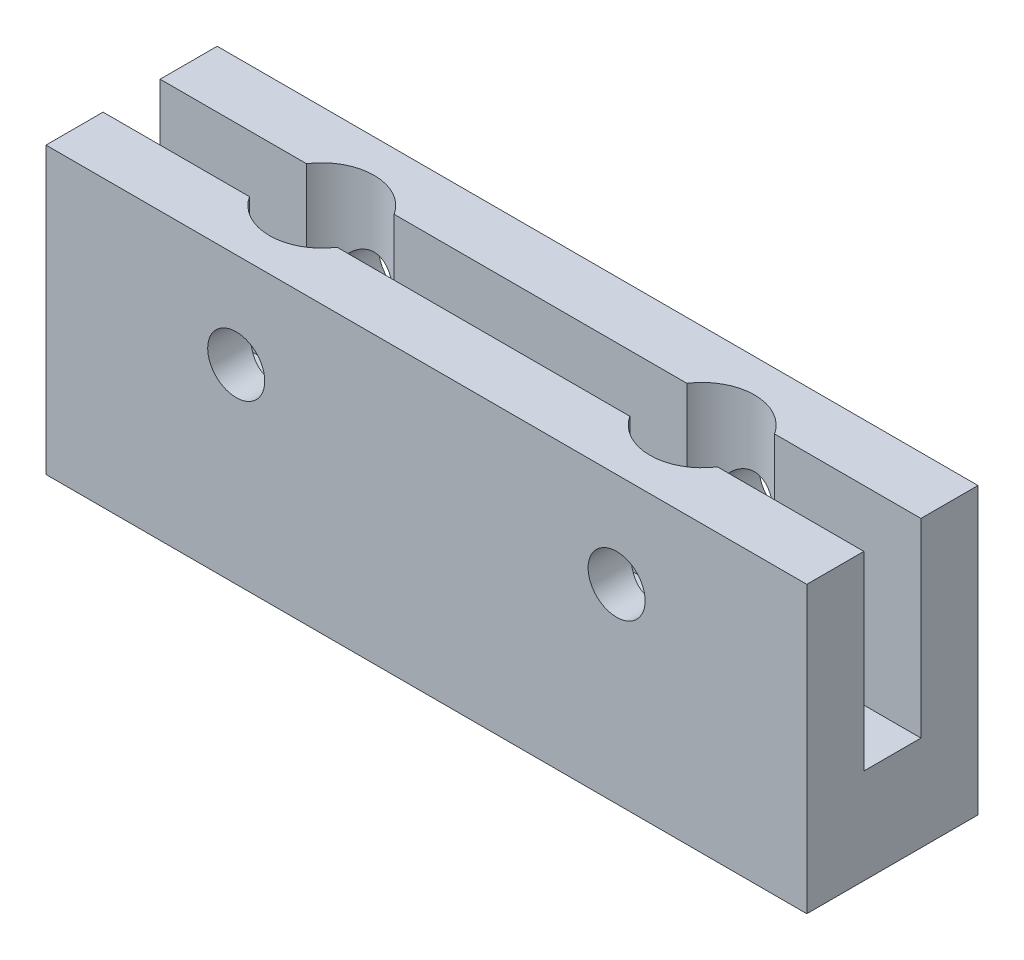
from build123d import *

# Parameters (mm, degrees)
SKETCH1_W               = 40
SKETCH1_H               = 9
BOSS_EXTRUDE1_DEPTH     = 5
SKETCH2_W               = 40
SKETCH2_H               = 3
BOSS_EXTRUDE4_DEPTH     = 10
CUT_EXTRUDE5_DEPTH      = 26.401771592
CUT_EXTRUDE5_DEPTH_BACK = 12.5
SKETCH4_R               = 2.75
CUT_EXTRUDE6_DEPTH      = 25.010414407
CUT_EXTRUDE6_DEPTH_BACK = 25.010414407
SKETCH5_R               = 1.5
CUT_EXTRUDE7_DEPTH      = 27.570660511
CUT_EXTRUDE7_DEPTH_BACK = 27.570660511
SKETCH6_R               = 1.5


with BuildPart() as part:
    # Sketch1 → Boss-Extrude1 (new body)
    with BuildSketch(Plane(origin=(0, 0, 0), x_dir=(1, 0, 0), z_dir=(0, 1, 0))):
        Rectangle(SKETCH1_W, SKETCH1_H)
    extrude(amount=BOSS_EXTRUDE1_DEPTH)

    # Sketch2 → Boss-Extrude4 (add)
    with BuildSketch(Plane(origin=(0, 5, 0), x_dir=(1, 0, 0), z_dir=(0, 1, 0))):
        with Locations((0, 3)):
            Rectangle(SKETCH2_W, SKETCH2_H)
        with Locations((0, -3)):
            Rectangle(SKETCH2_W, SKETCH2_H)
    extrude(amount=BOSS_EXTRUDE4_DEPTH)

    # Sketch4 → Cut-Extrude5 (cut, two sides: drawn at the far end of the back side and taken through both)
    with BuildSketch(Plane(origin=(0, 15, 0), x_dir=(1, 0, 0), z_dir=(0, 1, 0)).offset(-CUT_EXTRUDE5_DEPTH_BACK)):
        with Locations(Location((-10, 0, 0), (0, 0, 146.944268849))):
            Circle(SKETCH4_R)
        with Locations(Location((10, 0, 0), (0, 0, 90))):
            Circle(SKETCH4_R)
    extrude(amount=CUT_EXTRUDE5_DEPTH + CUT_EXTRUDE5_DEPTH_BACK, mode=Mode.SUBTRACT)

    # Sketch5 → Cut-Extrude6 (cut, two sides: drawn at the far end of the back side and taken through both)
    with BuildSketch(Plane(origin=(0, 2.5, 0), x_dir=(1, 0, 0), z_dir=(0, 1, 0)).offset(-CUT_EXTRUDE6_DEPTH_BACK)):
        with Locations(Location((-10, 0, 0), (0, 0, 270))):
            Circle(SKETCH5_R)
        with Locations(Location((10, 0, 0), (0, 0, 270))):
            Circle(SKETCH5_R)
    extrude(amount=CUT_EXTRUDE6_DEPTH + CUT_EXTRUDE6_DEPTH_BACK, mode=Mode.SUBTRACT)

    # Sketch6 → Cut-Extrude7 (cut, two sides: drawn at the far end of the back side and taken through both)
    with BuildSketch(Plane.XY.offset(4.5).offset(-CUT_EXTRUDE7_DEPTH_BACK)):
        with Locations((-10, 10)):
            Circle(SKETCH6_R)
        with Locations((10, 10)):
            Circle(SKETCH6_R)
    extrude(amount=CUT_EXTRUDE7_DEPTH + CUT_EXTRUDE7_DEPTH_BACK, mode=Mode.SUBTRACT)


solid = part.part
